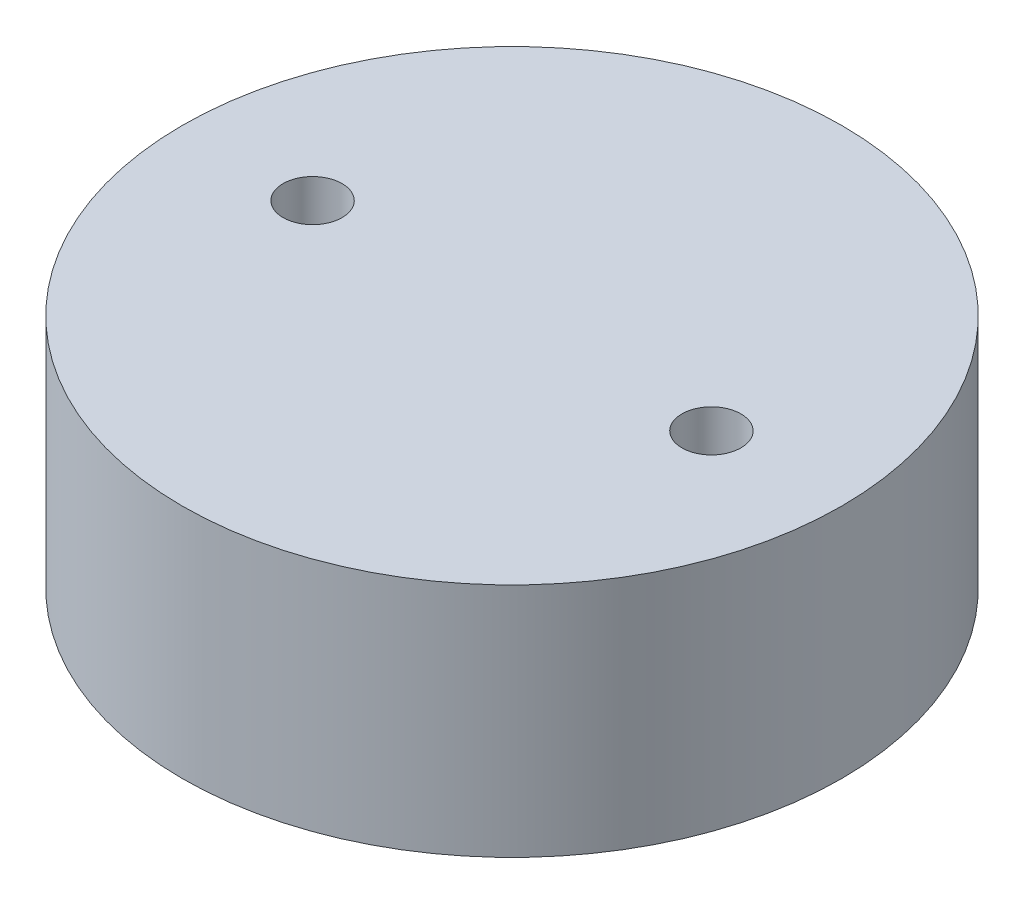
from build123d import *

# Parameters (mm, degrees)
SKETCH1_R           = 13.97
SKETCH1_R_2         = 1.25
BOSS_EXTRUDE1_DEPTH = 10


with BuildPart() as part:
    # Sketch1 → Boss-Extrude1 (new body)
    with BuildSketch(Plane(origin=(0, 0, 0), x_dir=(1, 0, 0), z_dir=(0, 1, 0))):
        with Locations(Location((0, 0, 0), (0, 0, 270))):
            Circle(SKETCH1_R)
        with Locations(Location((-8.45, 0, 0), (0, 0, 270))):
            Circle(SKETCH1_R_2, mode=Mode.SUBTRACT)
        with Locations(Location((8.45, 0, 0), (0, 0, 90))):
            Circle(SKETCH1_R_2, mode=Mode.SUBTRACT)
    extrude(amount=BOSS_EXTRUDE1_DEPTH)


solid = part.part
